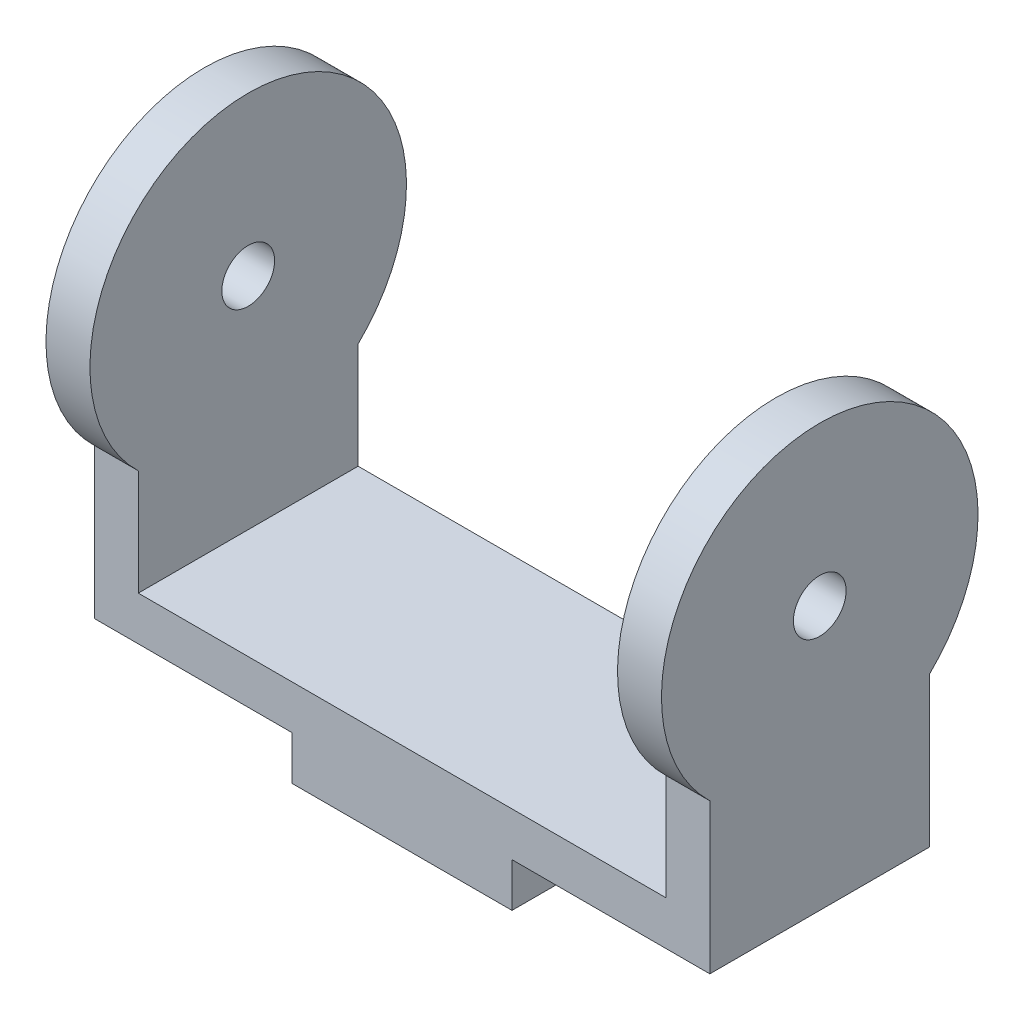
from build123d import *

# Parameters (mm, degrees)
SKETCH1_W           = 35
SKETCH1_H           = 25
BOSS_EXTRUDE1_DEPTH = 5
SKETCH7_R           = 18
SKETCH7_R_2         = 3
BOSS_EXTRUDE2_DEPTH = 5
SKETCH8_W           = 25
SKETCH8_H           = 25
BOSS_EXTRUDE3_DEPTH = 5


with BuildPart() as part:
    # Sketch1 → Boss-Extrude1 (new body)
    with BuildSketch(Plane(origin=(0, 0, 0), x_dir=(1, 0, 0), z_dir=(0, 1, 0))):
        with Locations((17.5, 0)):
            Rectangle(SKETCH1_W, SKETCH1_H)
    boss_extrude1 = extrude(amount=BOSS_EXTRUDE1_DEPTH)

    # Sketch7 → Boss-Extrude2 (add)
    # profile 1 of 2: a face of its own
    with BuildSketch(Plane(origin=(35, 0, 0), x_dir=(0, 0, -1), z_dir=(1, 0, 0))):
        with Locations((0, 30)):
            Circle(SKETCH7_R)
        with Locations((0, 30)):
            Circle(SKETCH7_R_2, mode=Mode.SUBTRACT)
    # profile 2 of 2: a face of its own
    with BuildSketch(Plane(origin=(35, 0, 0), x_dir=(0, 0, -1), z_dir=(1, 0, 0))):
        with BuildLine():
            Line((-12.5, 17.048166153), (-12.5, 5))
            Line((-12.5, 5), (12.5, 5))
            Line((12.5, 5), (12.5, 17.048166153))
            ThreePointArc((12.5, 17.048166153), (0, 12), (-12.5, 17.048166153))
        make_face()
    boss_extrude2 = extrude(amount=-BOSS_EXTRUDE2_DEPTH)

    # Mirror1: Boss-Extrude1, Boss-Extrude2 across plane
    add(boss_extrude1.mirror(Plane(origin=(0, 5, -12.5), x_dir=(0, 0, 1), z_dir=(1, 0, 0))))
    add(boss_extrude2.mirror(Plane(origin=(0, 5, -12.5), x_dir=(0, 0, 1), z_dir=(1, 0, 0))))

    # Sketch8 → Boss-Extrude3 (add)
    with BuildSketch(Plane.XZ):
        Rectangle(SKETCH8_W, SKETCH8_H)
    extrude(amount=BOSS_EXTRUDE3_DEPTH)


solid = part.part
